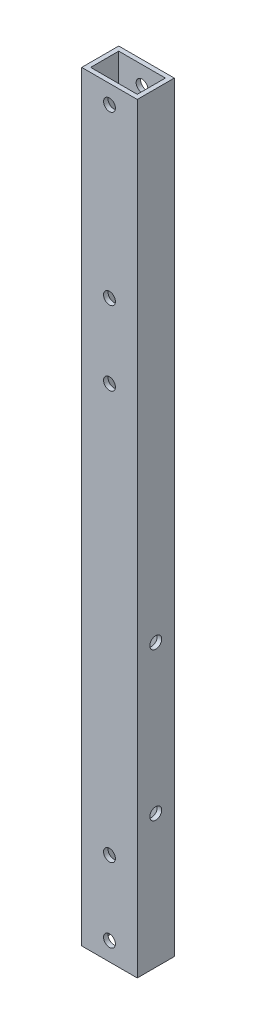
from build123d import *

# Parameters (mm, degrees)
SKETCH_1_W          = 15
SKETCH_1_H          = 10
SKETCH_1_W_2        = 12.6
SKETCH_1_H_2        = 7.6
EXTRUDE_1_DEPTH     = 110
SKETCH_2_R          = 1.6
CUT_EXTRUDE_1_DEPTH = 100
SKETCH_3_R          = 1.6
CUT_EXTRUDE_2_DEPTH = 15
SKETCH_4_R          = 1.6
CUT_EXTRUDE_3_DEPTH = 10
SKETCH_5_W          = 15
SKETCH_5_H          = 10
CUT_EXTRUDE_4_DEPTH = 14.5
SKETCH_6_R          = 1.6
CUT_EXTRUDE_5_DEPTH = 15


with BuildPart() as part:
    # ｽｹｯﾁ1 → ﾎﾞｽ - 押し出し1 (new, symmetric)
    with BuildSketch(Plane(origin=(0, 0, 0), x_dir=(1, 0, 0), z_dir=(0, 1, 0))):
        Rectangle(SKETCH_1_W, SKETCH_1_H)
        Rectangle(SKETCH_1_W_2, SKETCH_1_H_2, mode=Mode.SUBTRACT)
    extrude(amount=EXTRUDE_1_DEPTH, both=True)

    # ｽｹｯﾁ2 → ｶｯﾄ - 押し出し1 (cut)
    with BuildSketch(Plane(origin=(0, 0, -5), x_dir=(-1, 0, 0), z_dir=(0, 0, -1))):
        with Locations((0, -85)):
            Circle(SKETCH_2_R)
        with Locations((0, -105)):
            Circle(SKETCH_2_R)
    extrude(amount=-CUT_EXTRUDE_1_DEPTH, mode=Mode.SUBTRACT)

    # ｽｹｯﾁ3 → ｶｯﾄ - 押し出し2 (cut)
    with BuildSketch(Plane.ZY.offset(7.5)):
        with Locations((0, -74)):
            Circle(SKETCH_3_R)
        with Locations((0, -34)):
            Circle(SKETCH_3_R)
    extrude(amount=-CUT_EXTRUDE_2_DEPTH, mode=Mode.SUBTRACT)

    # ｽｹｯﾁ4 → ｶｯﾄ - 押し出し3 (cut)
    with BuildSketch(Plane(origin=(0, 0, -5), x_dir=(-1, 0, 0), z_dir=(0, 0, -1))):
        with Locations((0, 25.276513704)):
            Circle(SKETCH_4_R)
        with Locations((0, 45.276513704)):
            Circle(SKETCH_4_R)
    extrude(amount=-CUT_EXTRUDE_3_DEPTH, mode=Mode.SUBTRACT)

    # ｽｹｯﾁ5 → ｶｯﾄ - 押し出し4 (cut)
    with BuildSketch(Plane(origin=(0, 110, 0), x_dir=(1, 0, 0), z_dir=(0, 1, 0))):
        Rectangle(SKETCH_5_W, SKETCH_5_H)
    extrude(amount=-CUT_EXTRUDE_4_DEPTH, mode=Mode.SUBTRACT)

    # ｽｹｯﾁ6 → ｶｯﾄ - 押し出し5 (cut)
    with BuildSketch(Plane(origin=(0, 0, -5), x_dir=(-1, 0, 0), z_dir=(0, 0, -1))):
        with Locations((0, 90.5)):
            Circle(SKETCH_6_R)
    extrude(amount=-CUT_EXTRUDE_5_DEPTH, mode=Mode.SUBTRACT)


solid = part.part
